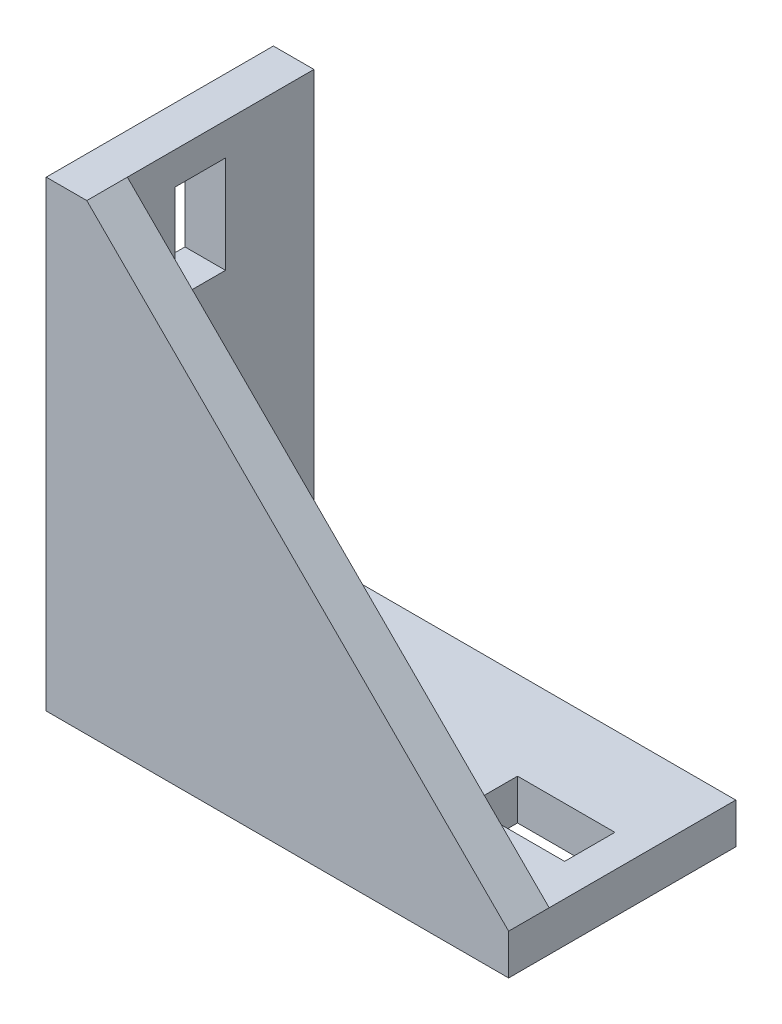
from build123d import *

# Parameters (mm, degrees)
BOSS_EXTRUDE1_DEPTH = 28
BOSS_EXTRUDE2_DEPTH = 5
SKETCH3_W           = 6.2
SKETCH3_H           = 12
CUT_EXTRUDE1_DEPTH  = 5
SKETCH4_W           = 12
SKETCH4_H           = 6.2
CUT_EXTRUDE2_DEPTH  = 5


with BuildPart() as part:
    # Sketch1 → Boss-Extrude1 (new body)
    with BuildSketch(Plane.XY):
        Polygon((5, 57), (5, 5), (57, 5), (57, 0), (0, 0), (0, 57), align=None)
    extrude(amount=BOSS_EXTRUDE1_DEPTH)

    # Sketch2 → Boss-Extrude2 (add)
    with BuildSketch(Plane.XY.offset(28)):
        Polygon((5, 57), (57, 5), (5, 5), align=None)
    extrude(amount=-BOSS_EXTRUDE2_DEPTH)

    # Sketch3 → Cut-Extrude1 (cut)
    with BuildSketch(Plane(origin=(5, 0, 0), x_dir=(0, 0, -1), z_dir=(1, 0, 0))):
        with Locations((-14, 47)):
            Rectangle(SKETCH3_W, SKETCH3_H)
        with Locations((-14, 15)):
            Rectangle(SKETCH3_W, SKETCH3_H)
    extrude(amount=-CUT_EXTRUDE1_DEPTH, mode=Mode.SUBTRACT)

    # Sketch4 → Cut-Extrude2 (cut)
    with BuildSketch(Plane(origin=(0, 5, 0), x_dir=(1, 0, 0), z_dir=(0, 1, 0))):
        with Locations((47, -14)):
            Rectangle(SKETCH4_W, SKETCH4_H)
        with Locations((15, -14)):
            Rectangle(SKETCH4_W, SKETCH4_H)
    extrude(amount=-CUT_EXTRUDE2_DEPTH, mode=Mode.SUBTRACT)


solid = part.part
